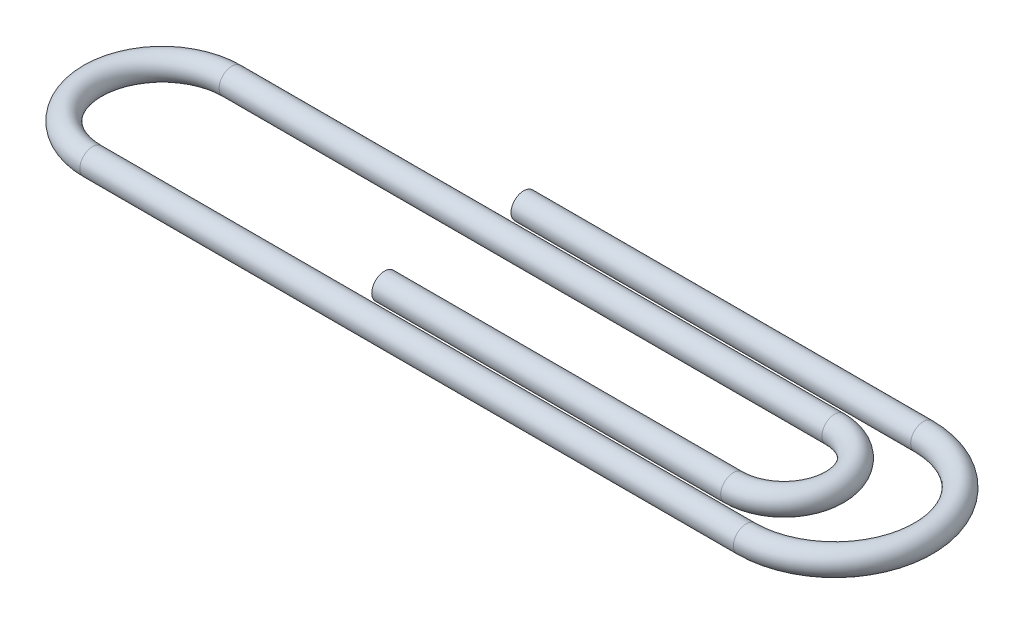
from build123d import *

# Parameters (mm, degrees)
SKETCH2_R = 0.5


with BuildPart() as part:
    # Sweep1: sweep along a path in Sketch1
    with BuildLine(Plane(origin=(0, 0, 0), x_dir=(1, 0, 0), z_dir=(0, 1, 0))) as sweep1_path:
        Line((10, 4.25), (25.75, 4.25))
        ThreePointArc((25.75, 4.25), (29.25, 0.75), (25.75, -2.75))
        Line((25.75, -2.75), (0, -2.75))
        ThreePointArc((0, -2.75), (-2.75, 0), (0, 2.75))
        Line((0, 2.75), (23.75, 2.75))
        ThreePointArc((23.75, 2.75), (25.75, 0.75), (23.75, -1.25))
        Line((23.75, -1.25), (10, -1.25))
    # Sketch2 → Sweep1 (sweep)
    with BuildSketch(Plane(origin=(10, 0, -4.25), x_dir=(0, 0, -1), z_dir=(1, 0, 0))):
        with Locations((-0.006617862, 0)):
            Circle(SKETCH2_R)
    sweep(path=sweep1_path.line)


solid = part.part
